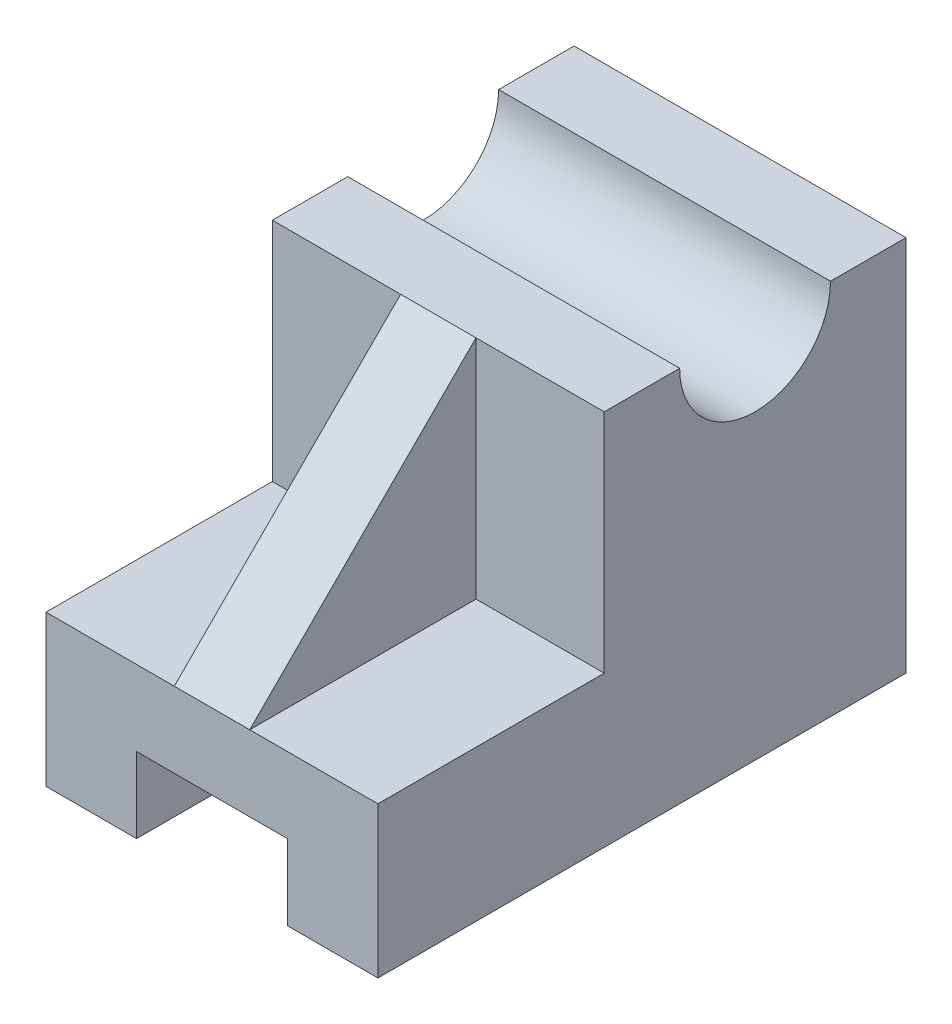
from build123d import *

# Parameters (mm, degrees)
BOSS_EXTRUDE1_DEPTH = 44
SKETCH2_R           = 10
CUT_EXTRUDE1_DEPTH  = 73.707908786
SKETCH3_W           = 20
SKETCH3_H           = 20
CUT_EXTRUDE2_DEPTH  = 87.977008456
RIB3_REACH          = 63.923
SKETCH4_WALL_W      = 168.272117334
SKETCH4_WALL_H      = 10


with BuildPart() as part:
    # Sketch1 → Boss-Extrude1 (new body)
    with BuildSketch(Plane(origin=(0, 0, 0), x_dir=(0, 0, -1), z_dir=(1, 0, 0))):
        Polygon((-18.8, -7), (-18.8, -27), (51.2, -27), (51.2, 23), (11.2, 23), (11.2, -7), align=None)
    extrude(amount=BOSS_EXTRUDE1_DEPTH)

    # Sketch2 → Cut-Extrude1 (cut, through all)
    with BuildSketch(Plane(origin=(44, 0, 0), x_dir=(0, 0, -1), z_dir=(1, 0, 0))):
        with Locations((31.2, 23)):
            Circle(SKETCH2_R)
    extrude(amount=-CUT_EXTRUDE1_DEPTH, mode=Mode.SUBTRACT)

    # Sketch3 → Cut-Extrude2 (cut, through all)
    with BuildSketch(Plane.XY.offset(18.8)):
        with Locations((22, -27)):
            Rectangle(SKETCH3_W, SKETCH3_H)
    extrude(amount=-CUT_EXTRUDE2_DEPTH, mode=Mode.SUBTRACT)

    # Sketch4 wall → Rib3 (add, up to next)
    with BuildSketch(Plane(origin=(22, 8, 3.8), x_dir=(0, -0.707106781187, 0.707106781187), z_dir=(0, -0.707106781187, -0.707106781187)), mode=Mode.PRIVATE) as rib3_sk1:
        Rectangle(SKETCH4_WALL_W, SKETCH4_WALL_H)
    rib3_tool1 = extrude(rib3_sk1.sketch, amount=RIB3_REACH, mode=Mode.PRIVATE) - part.part
    add(rib3_tool1.solids().sort_by_distance((22, 8, 3.8))[0])


solid = part.part
